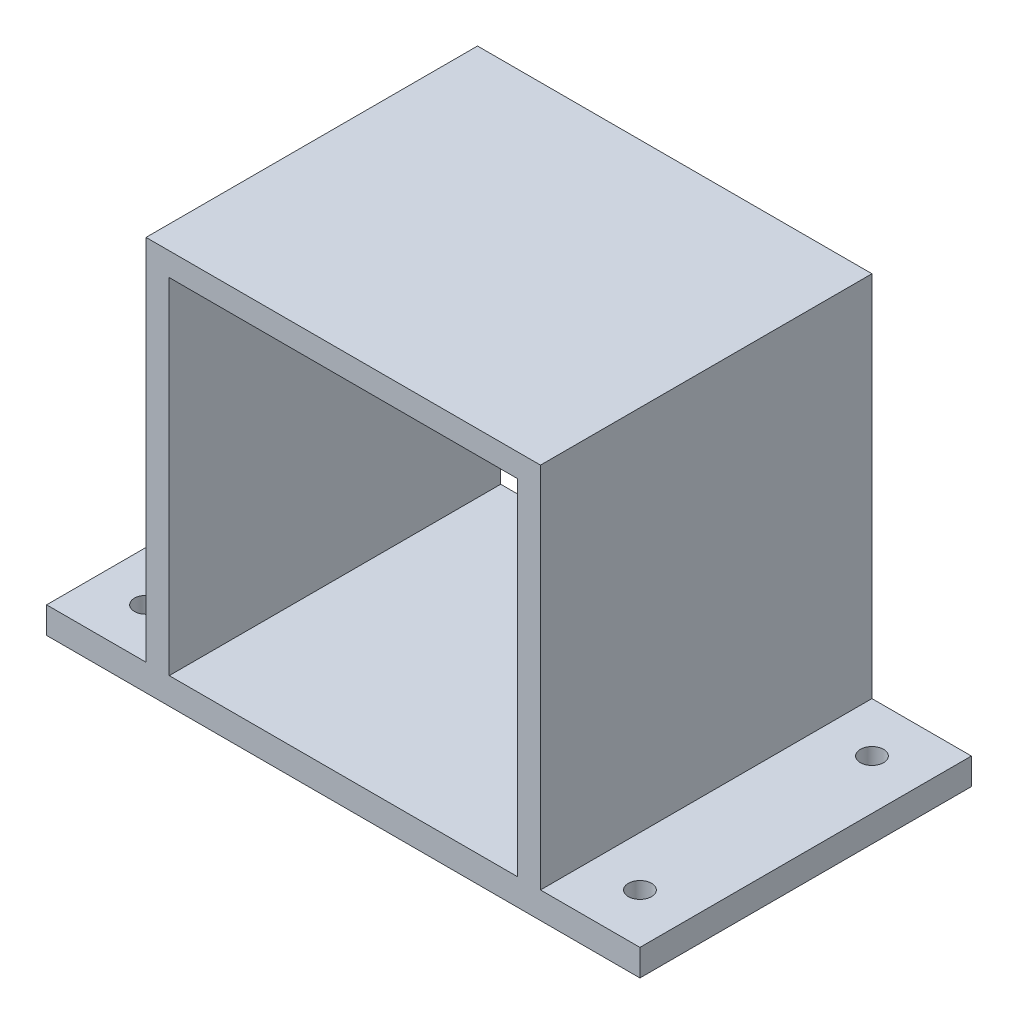
from build123d import *

# Parameters (mm, degrees)
SKETCH5_W           = 59.5
SKETCH5_H           = 59.5
SKETCH5_W_2         = 52.5
SKETCH5_H_2         = 52.5
BOSS_EXTRUDE5_DEPTH = 50
SKETCH7_R           = 1.75
BOSS_EXTRUDE7_DEPTH = 4


with BuildPart() as part:
    # Sketch5 → Boss-Extrude5 (new body)
    with BuildSketch(Plane.XY):
        with Locations((26.25, 26.25)):
            Rectangle(SKETCH5_W, SKETCH5_H)
        with Locations((26.25, 26.25)):
            Rectangle(SKETCH5_W_2, SKETCH5_H_2, mode=Mode.SUBTRACT)
    extrude(amount=BOSS_EXTRUDE5_DEPTH)

    # Sketch7 → Boss-Extrude7 (add)
    with BuildSketch(Plane.XZ.offset(3.5)):
        Polygon((-3.5, 50), (-18.5, 50), (-18.5, 0), (71, 0), (71, 50), (56, 50), align=None)
        with Locations(Location((-11, 42.5, 0), (0, 0, 270))):
            Circle(SKETCH7_R, mode=Mode.SUBTRACT)
        with Locations(Location((-11, 7.5, 0), (0, 0, 270))):
            Circle(SKETCH7_R, mode=Mode.SUBTRACT)
        with Locations(Location((63.5, 7.5, 0), (0, 0, 90))):
            Circle(SKETCH7_R, mode=Mode.SUBTRACT)
        with Locations(Location((63.5, 42.5, 0), (0, 0, 90))):
            Circle(SKETCH7_R, mode=Mode.SUBTRACT)
    extrude(amount=-BOSS_EXTRUDE7_DEPTH)


solid = part.part
